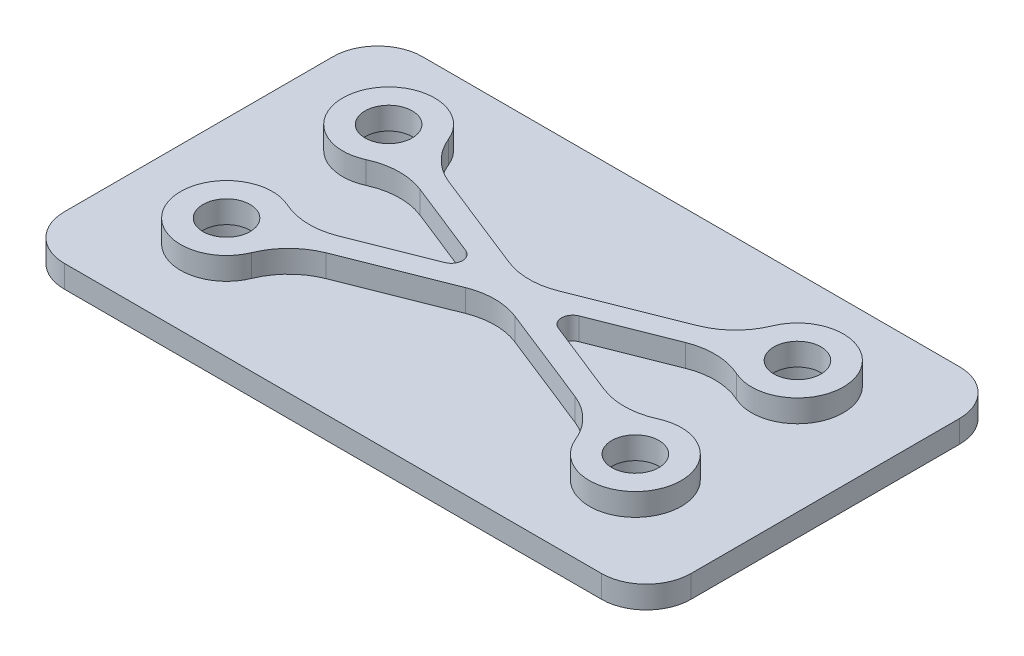
from build123d import *

# Parameters (mm, degrees)
SKETCH1_W               = 88.9
SKETCH1_H               = 50.8
BOSS_EXTRUDE1_DEPTH     = 3.175
BOSS_EXTRUDE3_DEPTH     = 3.175
FILLET1_R               = 9.525
FILLET2_R               = 1.5875
FILLET3_R               = 6.35
CUT_EXTRUDE1_DEPTH      = 52.293694794
CUT_EXTRUDE1_DEPTH_BACK = 52.293694794
SKETCH3_R               = 3.342712029
SKETCH4_R               = 4.7625
CUT_EXTRUDE2_DEPTH      = 52.587643882


with BuildPart() as part:
    # Sketch1 → Boss-Extrude1 (new body)
    with BuildSketch(Plane(origin=(0, 0, 0), x_dir=(1, 0, 0), z_dir=(0, 1, 0))):
        Rectangle(SKETCH1_W, SKETCH1_H)
    extrude(amount=BOSS_EXTRUDE1_DEPTH)

    # Fillet3
    fillet3_edges = [part.edges().sort_by_distance(p)[0] for p in [
        (-44.45, 1.5875, 25.4),
        (-44.45, 1.5875, -25.4),
        (44.45, 1.5875, -25.4),
        (44.45, 1.5875, 25.4),
    ]]
    fillet(fillet3_edges, radius=FILLET3_R)

    # Sketch3 → Cut-Extrude1 (cut, two sides: drawn at the far end of the back side and taken through both)
    with BuildSketch(Plane(origin=(0, 3.175, 0), x_dir=(1, 0, 0), z_dir=(0, 1, 0)).offset(-CUT_EXTRUDE1_DEPTH_BACK)):
        with Locations(Location((-29, 11.5, 0), (0, 0, 270))):
            Circle(SKETCH3_R)
        with Locations(Location((-29, -11.5, 0), (0, 0, 270))):
            Circle(SKETCH3_R)
        with Locations(Location((29, -11.5, 0), (0, 0, 270))):
            Circle(SKETCH3_R)
        with Locations(Location((29, 11.5, 0), (0, 0, 270))):
            Circle(SKETCH3_R)
    extrude(amount=CUT_EXTRUDE1_DEPTH + CUT_EXTRUDE1_DEPTH_BACK, mode=Mode.SUBTRACT)

    # Sketch4 → Cut-Extrude2 (cut, through all)
    with BuildSketch(Plane.XZ):
        with Locations(Location((29, 11.5, 0), (0, 0, 270))):
            Circle(SKETCH4_R)
        with Locations(Location((29, -11.5, 0), (0, 0, 270))):
            Circle(SKETCH4_R)
        with Locations(Location((-29, 11.5, 0), (0, 0, 270))):
            Circle(SKETCH4_R)
        with Locations(Location((-29, -11.5, 0), (0, 0, 270))):
            Circle(SKETCH4_R)
    extrude(amount=-CUT_EXTRUDE2_DEPTH, mode=Mode.SUBTRACT)


with BuildPart() as body_2:
    # Sketch2 → Boss-Extrude3 (new body)
    with BuildSketch(Plane(origin=(0, 3.175, 0), x_dir=(1, 0, 0), z_dir=(0, 1, 0))):
        with BuildLine():
            ThreePointArc((35.517712029, 11.5), (28.571807489, 18.00363139), (22.538549686, 10.645465083))
            Line((22.538549686, 10.645465083), (25.680272317, 11.89132061))
            ThreePointArc((25.680272317, 11.89132061), (29.195997513, 14.836960995), (32.342712029, 11.5))
            ThreePointArc((32.342712029, 11.5), (30.412284607, 8.470284519), (26.850658979, 8.939910767))
            Line((26.850658979, 8.939910767), (23.708936348, 7.69405524))
            ThreePointArc((23.708936348, 7.69405524), (30.99936751, 5.296525196), (35.517712029, 11.5))
        make_face()
        with BuildLine():
            Line((25.680272317, 11.89132061), (22.538549686, 10.645465083))
            ThreePointArc((22.538549686, 10.645465083), (22.941278918, 9.097403709), (23.708936348, 7.69405524))
            Line((23.708936348, 7.69405524), (26.850658979, 8.939910767))
            ThreePointArc((26.850658979, 8.939910767), (25.892688761, 10.267790371), (25.680272317, 11.89132061))
        make_face()
        with BuildLine():
            ThreePointArc((23.708936348, -7.69405524), (22.941278918, -9.097403709), (22.538549686, -10.645465083))
            Line((22.538549686, -10.645465083), (25.680272317, -11.89132061))
            ThreePointArc((25.680272317, -11.89132061), (25.892688761, -10.267790371), (26.850658979, -8.939910767))
            Line((26.850658979, -8.939910767), (23.708936348, -7.69405524))
        make_face()
        with BuildLine():
            Line((25.680272317, -11.89132061), (22.538549686, -10.645465083))
            ThreePointArc((22.538549686, -10.645465083), (28.571807489, -18.00363139), (35.517712029, -11.5))
            ThreePointArc((35.517712029, -11.5), (30.99936751, -5.296525196), (23.708936348, -7.69405524))
            Line((23.708936348, -7.69405524), (26.850658979, -8.939910767))
            ThreePointArc((26.850658979, -8.939910767), (30.412284607, -8.470284519), (32.342712029, -11.5))
            ThreePointArc((32.342712029, -11.5), (29.195997513, -14.836960995), (25.680272317, -11.89132061))
        make_face()
        with BuildLine():
            ThreePointArc((-22.538549686, -10.645465083), (-22.941278918, -9.097403709), (-23.708936348, -7.69405524))
            Line((-23.708936348, -7.69405524), (-26.850658979, -8.939910767))
            ThreePointArc((-26.850658979, -8.939910767), (-25.970284519, -10.087715393), (-25.657287971, -11.5))
            ThreePointArc((-25.657287971, -11.5), (-25.663039005, -11.695997513), (-25.680272317, -11.89132061))
            Line((-25.680272317, -11.89132061), (-22.538549686, -10.645465083))
        make_face()
        with BuildLine():
            Line((-26.850658979, -8.939910767), (-23.708936348, -7.69405524))
            ThreePointArc((-23.708936348, -7.69405524), (-35.203474804, -13.49936751), (-22.482287971, -11.5))
            ThreePointArc((-22.482287971, -11.5), (-22.49636861, -11.071807489), (-22.538549686, -10.645465083))
            Line((-22.538549686, -10.645465083), (-25.680272317, -11.89132061))
            ThreePointArc((-25.680272317, -11.89132061), (-32.107311239, -12.732209629), (-26.850658979, -8.939910767))
        make_face()
        with BuildLine():
            ThreePointArc((-25.657287971, 11.5), (-25.970284519, 10.087715393), (-26.850658979, 8.939910767))
            Line((-26.850658979, 8.939910767), (-23.708936348, 7.69405524))
            ThreePointArc((-23.708936348, 7.69405524), (-22.941278918, 9.097403709), (-22.538549686, 10.645465083))
            Line((-22.538549686, 10.645465083), (-25.680272317, 11.89132061))
            ThreePointArc((-25.680272317, 11.89132061), (-25.663039005, 11.695997513), (-25.657287971, 11.5))
        make_face()
        with BuildLine():
            Line((-23.708936348, 7.69405524), (-26.850658979, 8.939910767))
            ThreePointArc((-26.850658979, 8.939910767), (-32.107311239, 12.732209629), (-25.680272317, 11.89132061))
            Line((-25.680272317, 11.89132061), (-22.538549686, 10.645465083))
            ThreePointArc((-22.538549686, 10.645465083), (-22.49636861, 11.071807489), (-22.482287971, 11.5))
            ThreePointArc((-22.482287971, 11.5), (-35.203474804, 13.49936751), (-23.708936348, 7.69405524))
        make_face()
        with BuildLine():
            ThreePointArc((-22.538549686, 10.645465083), (-22.941278918, 9.097403709), (-23.708936348, 7.69405524))
            Line((-23.708936348, 7.69405524), (-4.306536177, 0))
            Line((-4.306536177, 0), (0, 1.707764346))
            Line((0, 1.707764346), (-22.538549686, 10.645465083))
        make_face()
        with BuildLine():
            Line((0, -1.707764346), (-4.306536177, 0))
            Line((-4.306536177, 0), (-23.708936348, -7.69405524))
            ThreePointArc((-23.708936348, -7.69405524), (-22.941278918, -9.097403709), (-22.538549686, -10.645465083))
            Line((-22.538549686, -10.645465083), (0, -1.707764346))
        make_face()
        with BuildLine():
            Line((22.538549686, 10.645465083), (0, 1.707764346))
            Line((0, 1.707764346), (4.306536177, 0))
            Line((4.306536177, 0), (23.708936348, 7.69405524))
            ThreePointArc((23.708936348, 7.69405524), (22.941278918, 9.097403709), (22.538549686, 10.645465083))
        make_face()
        with BuildLine():
            Line((4.306536177, 0), (0, -1.707764346))
            Line((0, -1.707764346), (22.538549686, -10.645465083))
            ThreePointArc((22.538549686, -10.645465083), (22.941278918, -9.097403709), (23.708936348, -7.69405524))
            Line((23.708936348, -7.69405524), (4.306536177, 0))
        make_face()
        Polygon((0, 1.707764346), (-4.306536177, 0), (0, -1.707764346), (4.306536177, 0), align=None)
    extrude(amount=BOSS_EXTRUDE3_DEPTH)

    # Fillet1
    fillet1_edges = [body_2.edges().sort_by_distance(p)[0] for p in [
        (-23.708936348, 4.7625, 7.69405524),
        (-23.708936348, 4.7625, -7.69405524),
        (-22.538549686, 4.7625, -10.645465083),
        (0, 4.7625, -1.707764346),
        (22.538549686, 4.7625, -10.645465083),
        (23.708936348, 4.7625, -7.69405524),
        (23.708936348, 4.7625, 7.69405524),
        (22.538549686, 4.7625, 10.645465083),
        (0, 4.7625, 1.707764346),
        (-22.538549686, 4.7625, 10.645465083),
    ]]
    fillet(fillet1_edges, radius=FILLET1_R)

    # Fillet2
    fillet2_edges = [body_2.edges().sort_by_distance(p)[0] for p in [
        (-4.306536177, 4.7625, 0),
        (4.306536177, 4.7625, 0),
    ]]
    fillet(fillet2_edges, radius=FILLET2_R)


solid = Compound([part.part, body_2.part])
